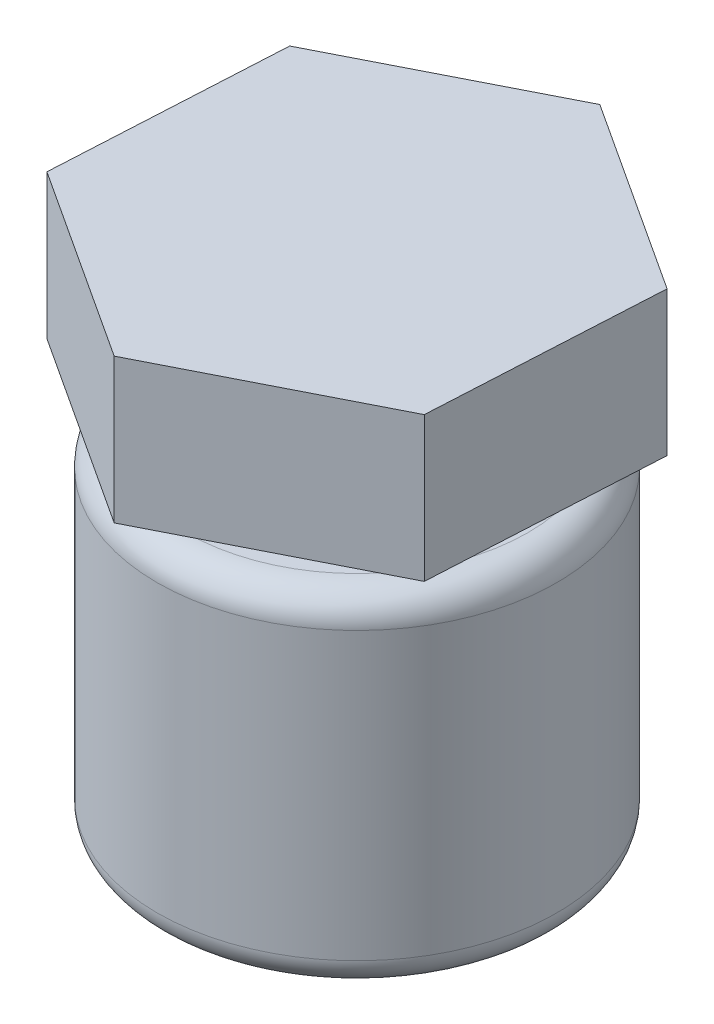
from build123d import *

# Parameters (mm, degrees)
FILLET1_R           = 10
FILLET2_R           = 10
BOSS_EXTRUDE1_DEPTH = 50


with BuildPart() as part:
    # Sketch1 → Revolve1 (revolve)
    with BuildSketch(Plane.XY):
        Polygon((0, 55.160580533), (6.058266255, 55.160580533), (6.058266255, 45.391125465), (11.493817419, 45.391125465), (11.493817419, 33.687279666), (12.618009156, 33.687279666), (12.618009156, 32.513459763), (11.493817419, 32.513459763), (11.493817419, 22.621974615), (69.148986921, 22.621974615), (69.148986921, -96.370180365), (0, -96.370180365), (0, -81.699979191), (63.128684076, -81.699979191), (63.128684076, 18.358315997), (5.351591255, 18.358315997), (0, 18.358315997), align=None)
    revolve(axis=Axis((0, 18.358315997, 0), (0, 1, 0)))

    # Fillet1
    fillet1_edges = [part.edges().sort_by_distance(p)[0] for p in [
        (-69.148986921, 22.621974615, 0),
    ]]
    fillet(fillet1_edges, radius=FILLET1_R)

    # Fillet2
    fillet2_edges = [part.edges().sort_by_distance(p)[0] for p in [
        (-69.148986921, -96.370180365, 0),
    ]]
    fillet(fillet2_edges, radius=FILLET2_R)


with BuildPart() as body_2:
    # Sketch2 → Boss-Extrude1 (new body)
    with BuildSketch(Plane(origin=(0, 33.687279666, 0), x_dir=(1, 0, 0), z_dir=(0, 1, 0))):
        Polygon((71.20521716, 36.1283855), (4.314508939, 79.729719693), (-66.890708221, 43.601334193), (-71.20521716, -36.1283855), (-4.314508939, -79.729719693), (66.890708221, -43.601334193), align=None)
    extrude(amount=BOSS_EXTRUDE1_DEPTH)

    # Sketch1<3> → Cut-Revolve1 (revolve, cut)
    with BuildSketch(Plane.XY):
        Polygon((0, 55.160580533), (6.058266255, 55.160580533), (6.058266255, 45.391125465), (11.493817419, 45.391125465), (11.493817419, 33.687279666), (12.618009156, 33.687279666), (12.618009156, 32.513459763), (11.493817419, 32.513459763), (11.493817419, 22.621974615), (69.148986921, 22.621974615), (69.148986921, -96.370180365), (0, -96.370180365), (0, -81.699979191), (63.128684076, -81.699979191), (63.128684076, 18.358315997), (5.351591255, 18.358315997), (0, 18.358315997), align=None)
    revolve(axis=Axis((0, 18.358315997, 0), (0, 1, 0)), mode=Mode.SUBTRACT)


solid = Compound([part.part, body_2.part])
